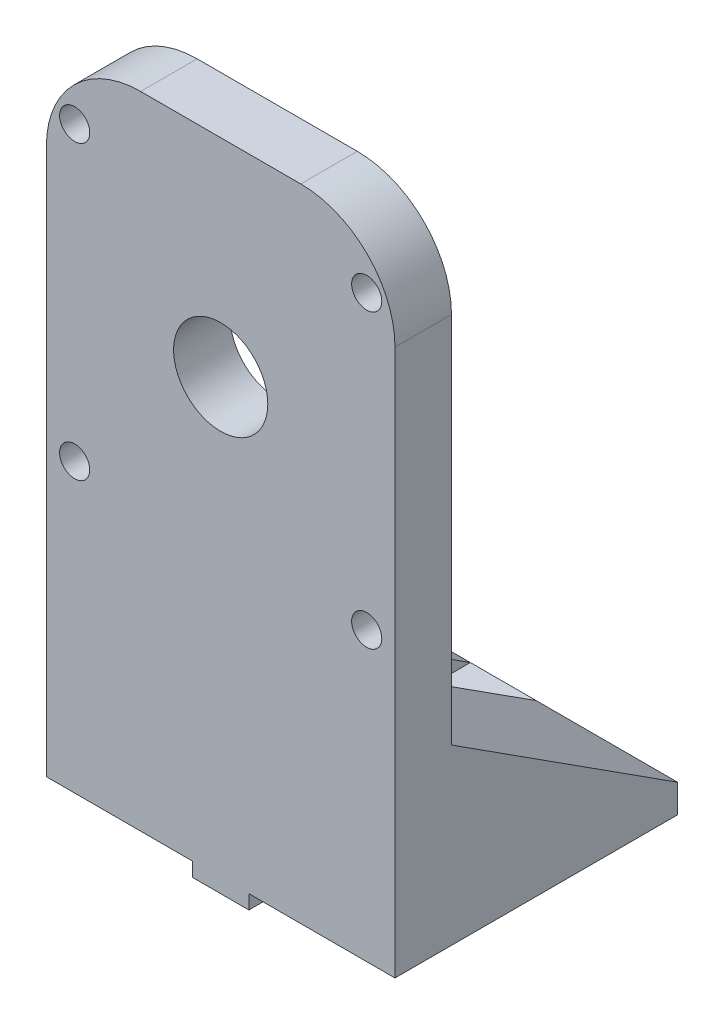
from build123d import *

# Parameters (mm, degrees)
SKETCH_1_R          = 5
EXTRUDE_1_DEPTH     = 6
FILLET_1_R          = 10
SKETCH_4_W          = 37
SKETCH_4_H          = 3
EXTRUDE_2_DEPTH     = 30
SKETCH_5_W          = 6
SKETCH_5_H          = 1.5
EXTRUDE_3_DEPTH     = 30
SKETCH_6_R          = 1.6
CUT_EXTRUDE_1_DEPTH = 10
EXTRUDE_5_DEPTH     = 15
SKETCH_10_R         = 1.75
CUT_EXTRUDE_3_DEPTH = 1000
EXTRUDE_6_DEPTH     = 15


with BuildPart() as part:
    # Эскиз1 → Бобышка-Вытянуть1 (new body)
    with BuildSketch(Plane.XY):
        Polygon((0, 0), (0, 65), (16, 65), (21, 65), (37, 65), (37, 0), align=None)
        with Locations((18.5, 43)):
            Circle(SKETCH_1_R, mode=Mode.SUBTRACT)
    extrude(amount=EXTRUDE_1_DEPTH)

    # Скругление1
    fillet_1_edges = [part.edges().sort_by_distance(p)[0] for p in [
        (0, 65, 3),
        (37, 65, 3),
    ]]
    fillet(fillet_1_edges, radius=FILLET_1_R)

    # Эскиз4 → Бобышка-Вытянуть2 (add)
    with BuildSketch(Plane.XY.offset(6)):
        with Locations((18.5, -1.5)):
            Rectangle(SKETCH_4_W, SKETCH_4_H)
    extrude(amount=-EXTRUDE_2_DEPTH)

    # Эскиз5 → Бобышка-Вытянуть3 (add)
    with BuildSketch(Plane.XY.offset(6)):
        with Locations((18.5, -3.75)):
            Rectangle(SKETCH_5_W, SKETCH_5_H)
    extrude(amount=-EXTRUDE_3_DEPTH)

    # Эскиз6 → Вырез-Вытянуть1 (cut)
    with BuildSketch(Plane.XY.offset(6)):
        with Locations((3, 27.5)):
            Circle(SKETCH_6_R)
        with Locations((3, 58.5)):
            Circle(SKETCH_6_R)
        with Locations((34, 27.5)):
            Circle(SKETCH_6_R)
        with Locations((34, 58.5)):
            Circle(SKETCH_6_R)
    extrude(amount=-CUT_EXTRUDE_1_DEPTH, mode=Mode.SUBTRACT)

    # Эскиз9 → Бобышка-Вытянуть5 (add)
    with BuildSketch(Plane.ZY):
        Polygon((-24, 0), (0, 0), (0, 15.416167011), align=None)
    extrude(amount=-EXTRUDE_5_DEPTH)

    # Эскиз10 → Вырез-Вытянуть3 (cut)
    with BuildSketch(Plane.XZ.offset(4.5)):
        with Locations((18.5, -18)):
            Circle(SKETCH_10_R)
        with Locations((18.425804873, -4)):
            Circle(SKETCH_10_R)
    extrude(amount=-CUT_EXTRUDE_3_DEPTH, mode=Mode.SUBTRACT)

    # Эскиз11 → Бобышка-Вытянуть6 (add)
    with BuildSketch(Plane(origin=(37, 0, 0), x_dir=(0, 0, -1), z_dir=(1, 0, 0))):
        Polygon((0, 0), (24, 0), (0, 15.416167011), align=None)
    extrude(amount=-EXTRUDE_6_DEPTH)


solid = part.part
